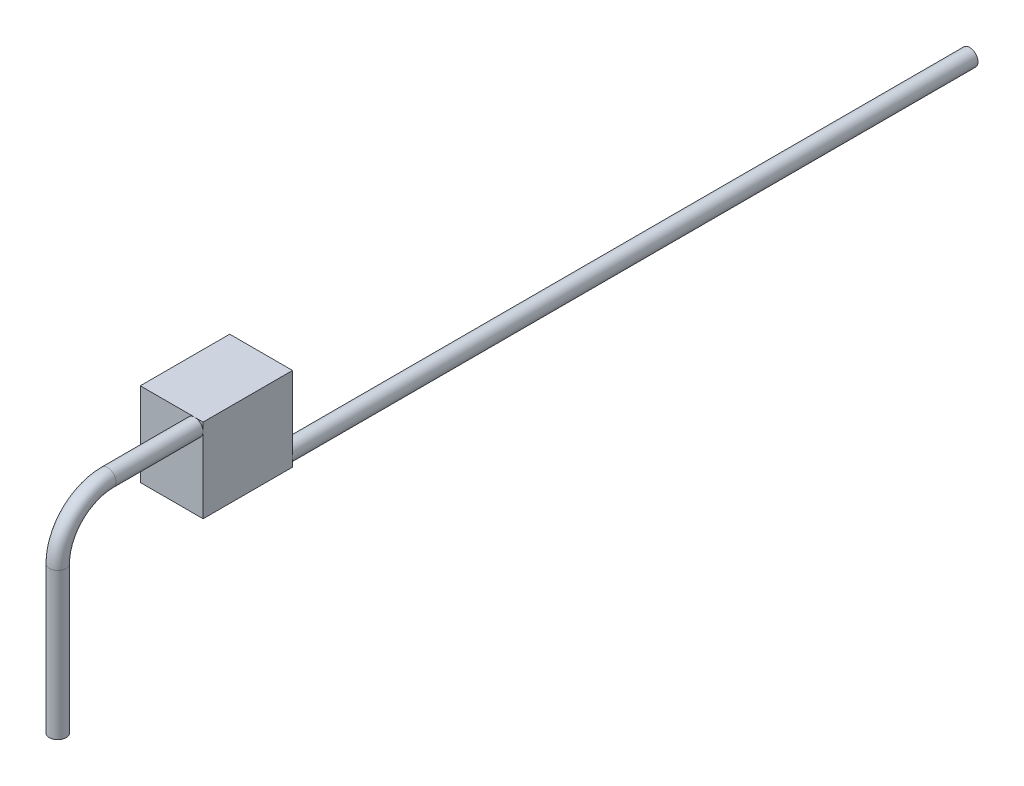
from build123d import *

# Parameters (mm, degrees)
SKETCH1_R                = 1.984375
BOSS_EXTRUDE1_DEPTH      = 170
BOSS_EXTRUDE2_DEPTH      = 15
BOSS_EXTRUDE2_DEPTH_BACK = 6.35
SKETCH2_W                = 15
SKETCH2_H                = 20
SKETCH3_R                = 1.984375
BOSS_EXTRUDE3_DEPTH      = 20.799999976
SKETCH4_R                = 1.984375
REVOLVE5_ANGLE           = 90
SKETCH6_R                = 1.984375
BOSS_EXTRUDE4_DEPTH      = 35.000000038


with BuildPart() as part:
    # Sketch1 → Boss-Extrude1 (new body)
    with BuildSketch(Plane.XY):
        Circle(SKETCH1_R)
    extrude(amount=BOSS_EXTRUDE1_DEPTH)

    # Sketch2 → Boss-Extrude2 (add, two sides: drawn at the far end of the back side and taken through both)
    with BuildSketch(Plane.XY.offset(170).offset(-BOSS_EXTRUDE2_DEPTH_BACK)):
        with Locations((-5.515625, 8.015625)):
            Rectangle(SKETCH2_W, SKETCH2_H)
    extrude(amount=BOSS_EXTRUDE2_DEPTH + BOSS_EXTRUDE2_DEPTH_BACK)

    # Sketch3 → Boss-Extrude3 (add)
    with BuildSketch(Plane.XY.offset(185)):
        with Locations((0, 16.03125)):
            Circle(SKETCH3_R)
    extrude(amount=BOSS_EXTRUDE3_DEPTH)

    # Sketch4 → Revolve5 (revolve)
    with BuildSketch(Plane.XY.offset(205.799999976)):
        with Locations(Location((0, 16.03125, 0), (0, 0, 90))):
            Circle(SKETCH4_R)
    revolve(axis=Axis((-5.972283048, 4.112992181, 205.799999976), (1, 0, 0)), revolution_arc=REVOLVE5_ANGLE)

    # Sketch6 → Boss-Extrude4 (add)
    with BuildSketch(Plane.XZ.offset(-4.112992181)):
        with Locations(Location((0, 217.718257795, 0), (0, 0, 90))):
            Circle(SKETCH6_R)
    extrude(amount=BOSS_EXTRUDE4_DEPTH)


solid = part.part
